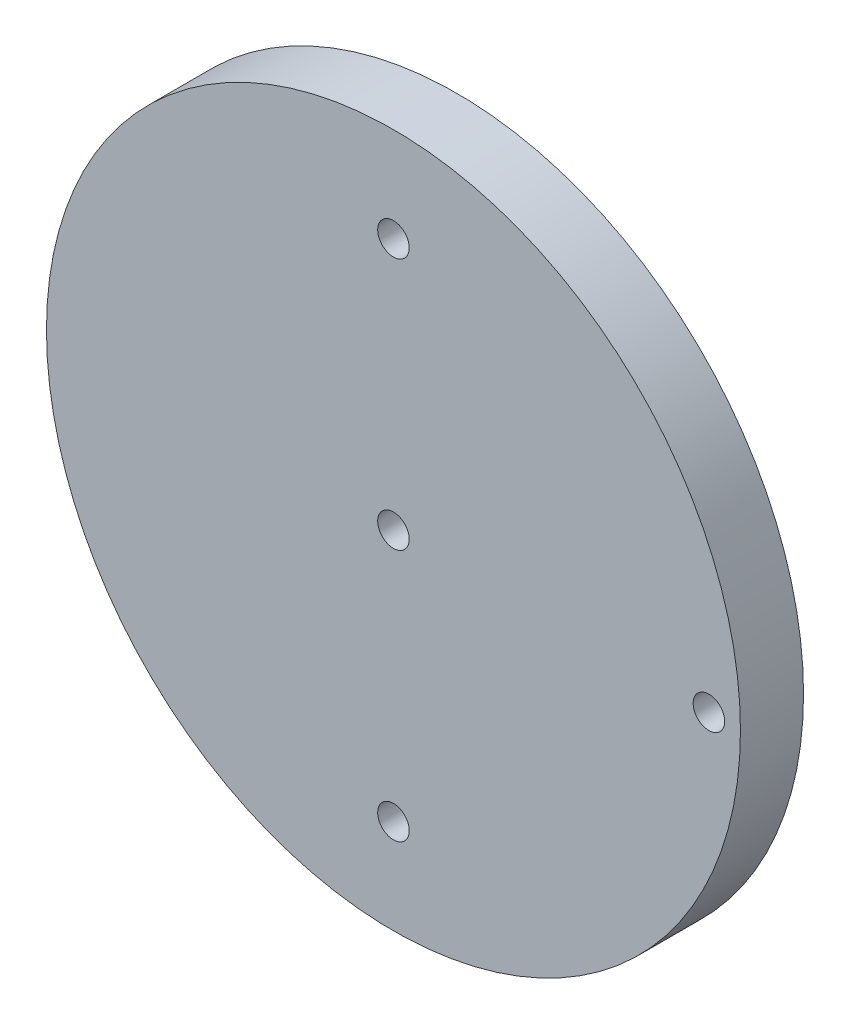
from build123d import *

# Parameters (mm, degrees)
SKETCH_1_R          = 55
EXTRUDE_1_DEPTH     = 10
SKETCH_2_R          = 2.5
CUT_EXTRUDE_1_DEPTH = 79.421935707
SKETCH_4_R          = 2.5
CUT_EXTRUDE_2_DEPTH = 79.421935707


with BuildPart() as part:
    # 草图1 → 凸台-拉伸1 (new body)
    with BuildSketch(Plane.XY):
        Circle(SKETCH_1_R)
    extrude(amount=EXTRUDE_1_DEPTH)

    # 草图2 → 切除-拉伸1 (cut, through all)
    with BuildSketch(Plane.XY.offset(10)):
        Circle(SKETCH_2_R)
        with Locations((50, 0)):
            Circle(SKETCH_2_R)
    extrude(amount=-CUT_EXTRUDE_1_DEPTH, mode=Mode.SUBTRACT)

    # 草图4 → 切除-拉伸2 (cut, through all)
    with BuildSketch(Plane(origin=(0, 0, 0), x_dir=(-1, 0, 0), z_dir=(0, 0, -1))):
        with Locations((0, -40)):
            Circle(SKETCH_4_R)
        with Locations((0, 40)):
            Circle(SKETCH_4_R)
    extrude(amount=-CUT_EXTRUDE_2_DEPTH, mode=Mode.SUBTRACT)


solid = part.part
